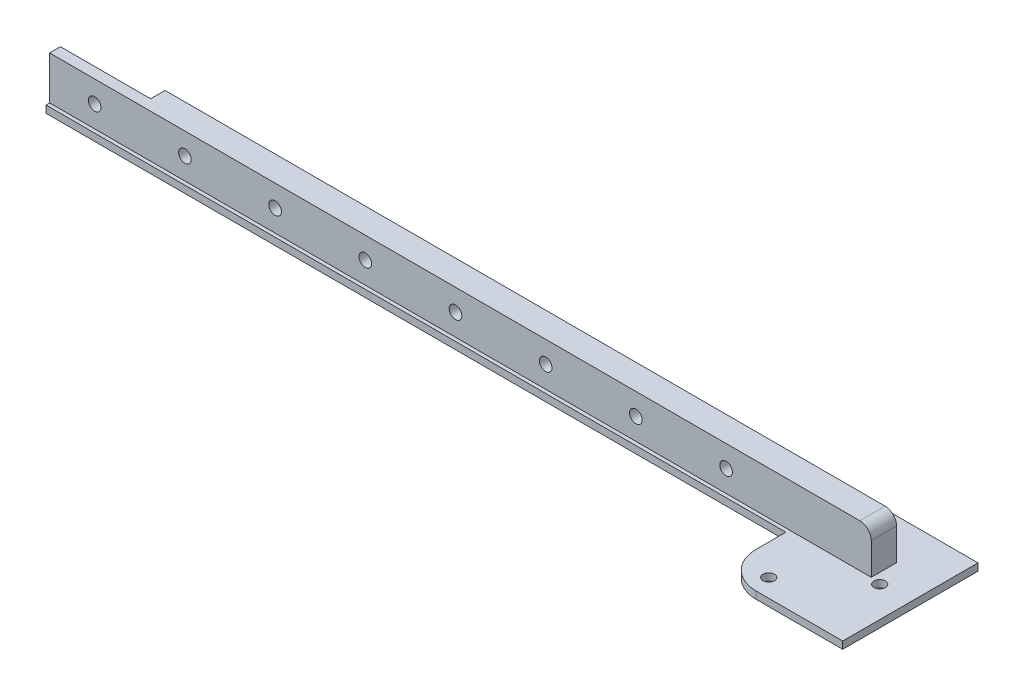
from build123d import *

# Parameters (mm, degrees)
TOPSKETCH1_R                        = 1.59
TOPBOSS_EXTRUDE1_DEPTH              = 2
FILLET1_R                           = 10
LINEARRAILHEIGHTSKETCH2_W           = 227.746666667
LINEARRAILHEIGHTSKETCH2_H           = 7
LINEARRAILHEIGHTBOSS_EXTRUDE2_DEPTH = 12
LINEARRAILHOLESSKETCH3_R            = 1.75
LINEARRAILHOLESCUT_EXTRUDE1_DEPTH   = 207.456699819
CONNECTINGPLATESKETCH2_W            = 25
CONNECTINGPLATESKETCH2_H            = 14
CONNECTINGPLATECUT_EXTRUDE1_DEPTH   = 4
FILLET2_R                           = 3.175


with BuildPart() as part:
    # TopSketch1 → TopBoss-Extrude1 (new body)
    with BuildSketch(Plane(origin=(0, 0, 0), x_dir=(1, 0, 0), z_dir=(0, 1, 0))):
        Polygon((0, 0), (34, 0), (34, 37.5), (0, 37.5), (0, 26.25), (-205.08, 26.25), (-205.08, 18.25), (0, 18.25), align=None)
        with Locations(Location((8.5, 32.5, 0), (0, 0, 270))):
            Circle(TOPSKETCH1_R, mode=Mode.SUBTRACT)
        with Locations(Location((8.5, 5, 0), (0, 0, 270))):
            Circle(TOPSKETCH1_R, mode=Mode.SUBTRACT)
        with Locations(Location((25.5, 18.75, 0), (0, 0, 270))):
            Circle(TOPSKETCH1_R, mode=Mode.SUBTRACT)
    extrude(amount=TOPBOSS_EXTRUDE1_DEPTH)

    # Fillet1
    fillet1_edges = [part.edges().sort_by_distance(p)[0] for p in [
        (0, 1, -37.5),
        (0, 1, 0),
    ]]
    fillet(fillet1_edges, radius=FILLET1_R)

    # LinearRailHEightSketch2 → LinearRailHeightBoss-Extrude2 (add)
    with BuildSketch(Plane(origin=(0, 2, 0), x_dir=(1, 0, 0), z_dir=(0, 1, 0))):
        with Locations((-91.206666667, 22.75)):
            Rectangle(LINEARRAILHEIGHTSKETCH2_W, LINEARRAILHEIGHTSKETCH2_H)
    extrude(amount=LINEARRAILHEIGHTBOSS_EXTRUDE2_DEPTH)

    # LinearRailHolesSketch3 → LinearRailHolesCut-Extrude1 (cut, through all)
    with BuildSketch(Plane.XY.offset(-19.25)):
        with Locations((-192.58, 8)):
            Circle(LINEARRAILHOLESSKETCH3_R)
        with Locations((-167.58, 8)):
            Circle(LINEARRAILHOLESSKETCH3_R)
        with Locations((-142.58, 8)):
            Circle(LINEARRAILHOLESSKETCH3_R)
        with Locations((-117.58, 8)):
            Circle(LINEARRAILHOLESSKETCH3_R)
        with Locations((-92.58, 8)):
            Circle(LINEARRAILHOLESSKETCH3_R)
        with Locations((-67.58, 8)):
            Circle(LINEARRAILHOLESSKETCH3_R)
        with Locations((-42.58, 8)):
            Circle(LINEARRAILHOLESSKETCH3_R)
        with Locations((-17.58, 8)):
            Circle(LINEARRAILHOLESSKETCH3_R)
    extrude(amount=-LINEARRAILHOLESCUT_EXTRUDE1_DEPTH, mode=Mode.SUBTRACT)

    # ConnectingPlateSketch2 → ConnectingPlateCut-Extrude1 (cut)
    with BuildSketch(Plane(origin=(0, 0, -26.25), x_dir=(-1, 0, 0), z_dir=(0, 0, -1))):
        with Locations((192.58, 7)):
            Rectangle(CONNECTINGPLATESKETCH2_W, CONNECTINGPLATESKETCH2_H)
    extrude(amount=-CONNECTINGPLATECUT_EXTRUDE1_DEPTH, mode=Mode.SUBTRACT)

    # Fillet2
    fillet2_edges = [part.edges().sort_by_distance(p)[0] for p in [
        (22.666666667, 14, -22.75),
    ]]
    fillet(fillet2_edges, radius=FILLET2_R)


solid = part.part
